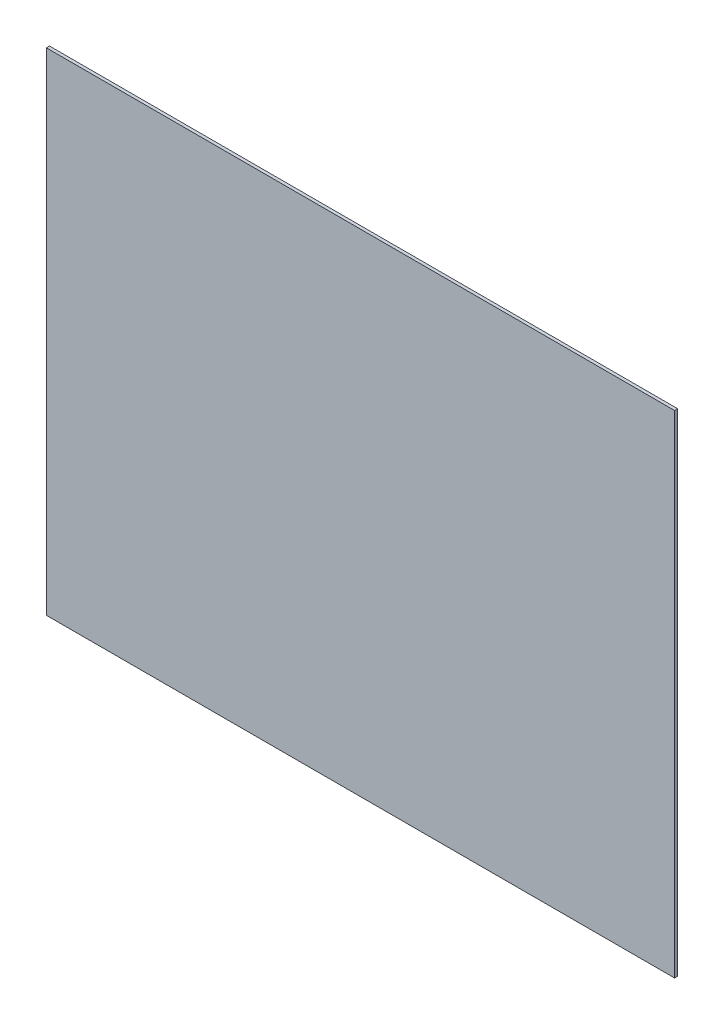
from build123d import *

# Parameters (mm, degrees)
SKETCH1_W           = 465.074
SKETCH1_H           = 363.9
BOSS_EXTRUDE1_DEPTH = 2.286


with BuildPart() as part:
    # Sketch1 → Boss-Extrude1 (new body)
    with BuildSketch(Plane.XY):
        Rectangle(SKETCH1_W, SKETCH1_H)
    extrude(amount=BOSS_EXTRUDE1_DEPTH)


solid = part.part
